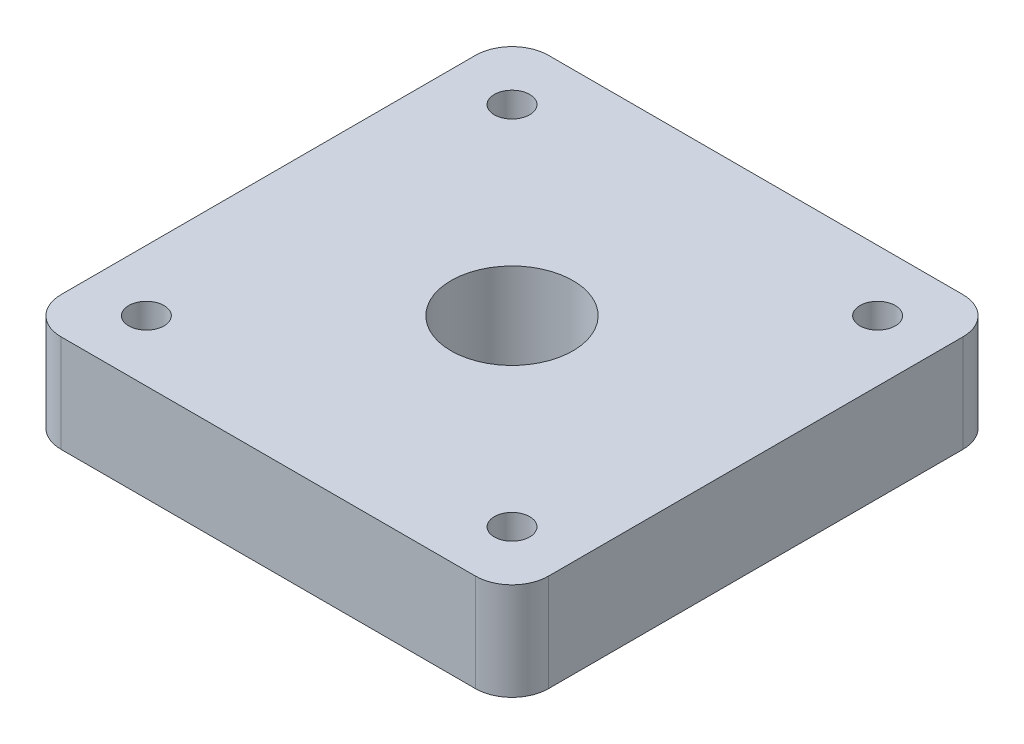
from build123d import *

# Parameters (mm, degrees)
SKETCH1_W           = 40
SKETCH1_H           = 40
SKETCH1_R           = 5
BOSS_EXTRUDE1_DEPTH = 8
SKETCH12_R          = 1.45
CUT_EXTRUDE1_DEPTH  = 58.053472861
FILLET1_R           = 3


with BuildPart() as part:
    # Sketch1 → Boss-Extrude1 (new body)
    with BuildSketch(Plane(origin=(0, 0, 0), x_dir=(1, 0, 0), z_dir=(0, 1, 0))):
        with Locations((20, -19.888579387)):
            Rectangle(SKETCH1_W, SKETCH1_H)
        with Locations(Location((20, -19.888579387, 0), (0, 0, 270))):
            Circle(SKETCH1_R, mode=Mode.SUBTRACT)
    extrude(amount=BOSS_EXTRUDE1_DEPTH)

    # Sketch12 → Cut-Extrude1 (cut, through all)
    with BuildSketch(Plane(origin=(0, 8, 0), x_dir=(1, 0, 0), z_dir=(0, 1, 0))):
        with Locations(Location((5, -4.888579387, 0), (0, 0, 270))):
            Circle(SKETCH12_R)
        with Locations(Location((35, -4.888579387, 0), (0, 0, 270))):
            Circle(SKETCH12_R)
        with Locations(Location((35, -34.888579387, 0), (0, 0, 270))):
            Circle(SKETCH12_R)
        with Locations(Location((5, -34.888579387, 0), (0, 0, 270))):
            Circle(SKETCH12_R)
    extrude(amount=-CUT_EXTRUDE1_DEPTH, mode=Mode.SUBTRACT)

    # Fillet1
    fillet1_edges = [part.edges().sort_by_distance(p)[0] for p in [
        (0, 4, -0.111420613),
        (40, 4, -0.111420613),
        (40, 4, 39.888579387),
        (0, 4, 39.888579387),
    ]]
    fillet(fillet1_edges, radius=FILLET1_R)


solid = part.part
